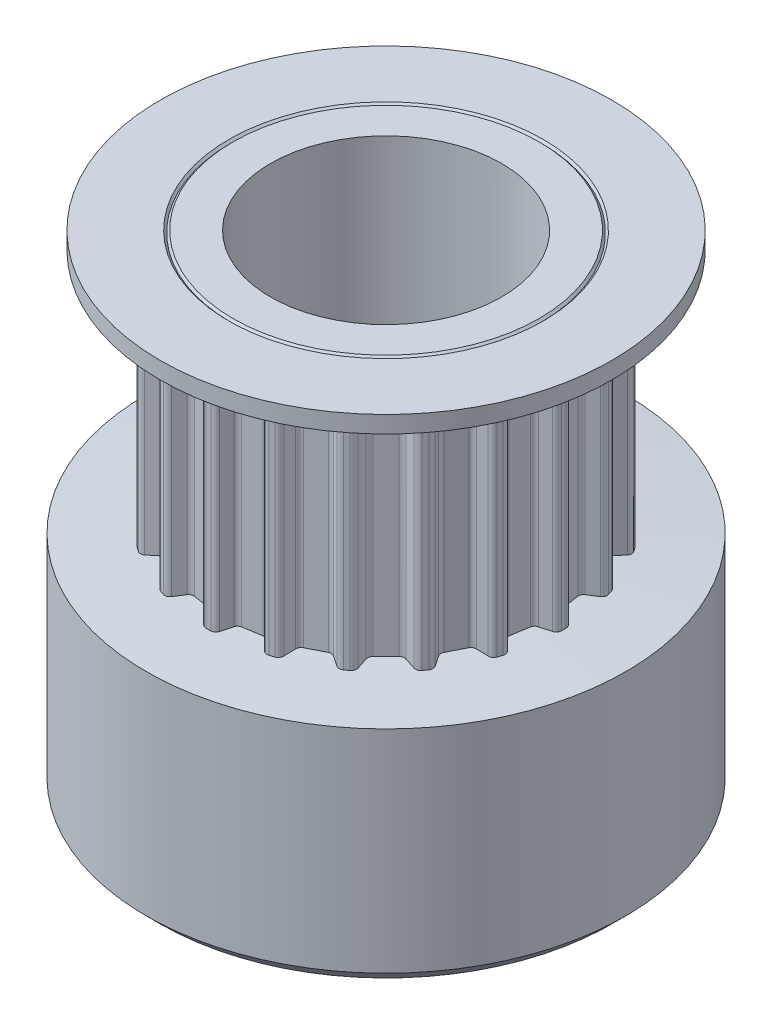
from build123d import *

# Parameters (mm, degrees)
TOOTH_DEPTH                = 4.35
TOOTH_PATTERN_COUNT        = 20
M3X0_5_SETSCEW_HOLE_REACH  = 22.882
M3X0_5_SETSCEW_HOLE_BORE_R = 1.25


with BuildPart() as part:
    # Sketch1 → Profile (revolve)
    with BuildSketch(Plane(origin=(0, 0, 0), x_dir=(0, 0, -1), z_dir=(1, 0, 0))):
        Polygon((4.1, -8.65), (4.1, 8.65), (5.425, 8.65), (5.5, 8.575), (5.575, 8.65), (7.999997357, 8.65), (7.999997357, 8.050000565), (5.5, 7.831279137), (5.5, -0.387534009), (8.5, -0.65), (8.5, -8.15), (8, -8.65), align=None)
    revolve(axis=Axis((0, -99.30835098, 0), (0, 1, 0)))

    # Sketch5 → Tooth (add, symmetric)
    with BuildSketch(Plane(origin=(0, 3.7, 0), x_dir=(-1, 0, 0), z_dir=(0, -1, 0))):
        with BuildLine():
            Line((-0.565527388, 5.681480478), (-1.217825514, 5.578166605))
            Line((-1.217825514, 5.578166605), (-1.066479855, 4.884938149))
            ThreePointArc((-1.066479855, 4.884938149), (-0.289177032, 4.99163066), (0.495246289, 4.975412658))
            Line((0.495246289, 4.975412658), (0.565527388, 5.681480478))
            ThreePointArc((0.565527388, 5.681480478), (0.470950203, 5.723588954), (0.410098195, 5.807344556))
            Line((0.410098195, 5.807344556), (0.270466085, 6.17109864))
            ThreePointArc((0.270466085, 6.17109864), (0.198160089, 6.263468737), (0.086495902, 6.299406199))
            ThreePointArc((0.086495902, 6.299406199), (0, 6.3), (-0.086495902, 6.299406199))
            ThreePointArc((-0.086495902, 6.299406199), (-0.198160089, 6.263468737), (-0.270466085, 6.17109864))
            Line((-0.270466085, 6.17109864), (-0.410098195, 5.807344556))
            ThreePointArc((-0.410098195, 5.807344556), (-0.470950203, 5.723588954), (-0.565527388, 5.681480478))
        make_face()
    tooth = extrude(amount=TOOTH_DEPTH, both=True)

    # Tooth Pattern: Tooth ×20 about axis
    tooth_pattern_axis = Axis((0, 0, 0), (0, 1, 0))
    for i in range(1, TOOTH_PATTERN_COUNT):
        add(tooth.rotate(tooth_pattern_axis, i * 360 / TOOTH_PATTERN_COUNT))

    # M3x0.5 Setscew Hole bore → M3x0.5 Setscew Hole (cut, up to next)
    with BuildSketch(Plane(origin=(0, 0, -8.5), x_dir=(-1, 0, 0), z_dir=(0, 0, -1)), mode=Mode.PRIVATE) as m3x0_5_setscew_hole_sk1:
        with Locations((0, -4.65)):
            Circle(M3X0_5_SETSCEW_HOLE_BORE_R)
    m3x0_5_setscew_hole_tool1 = extrude(m3x0_5_setscew_hole_sk1.sketch, amount=-M3X0_5_SETSCEW_HOLE_REACH, mode=Mode.PRIVATE) & part.part
    add(m3x0_5_setscew_hole_tool1.solids().sort_by_distance((0, -4.65, -8.5))[0], mode=Mode.SUBTRACT)


solid = part.part
